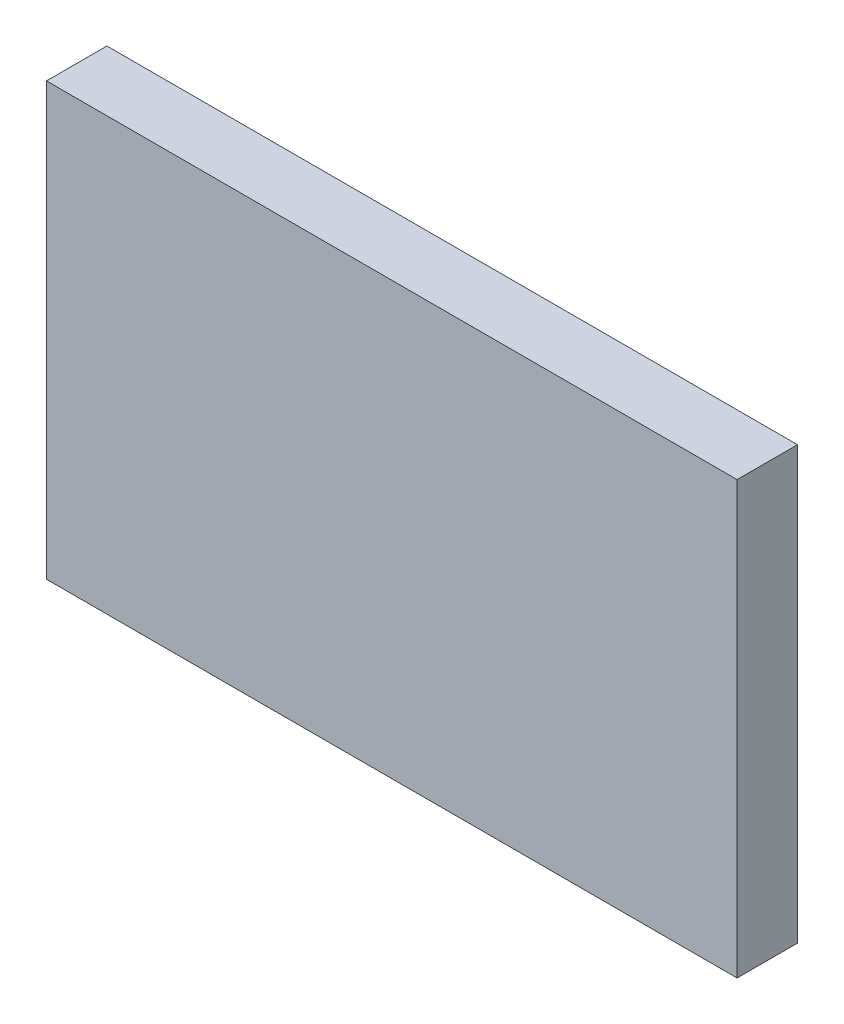
from build123d import *

# Parameters (mm, degrees)
SKETCH4_W           = 80
SKETCH4_H           = 50
BOSS_EXTRUDE2_DEPTH = 7
CUT_EXTRUDE2_DEPTH  = 4


with BuildPart() as part:
    # Sketch4 → Boss-Extrude2 (new body)
    with BuildSketch(Plane.XY):
        Rectangle(SKETCH4_W, SKETCH4_H)
    extrude(amount=-BOSS_EXTRUDE2_DEPTH)

    # Sketch8 → Cut-Extrude2 (cut)
    with BuildSketch(Plane(origin=(0, 0, -7), x_dir=(-1, 0, 0), z_dir=(0, 0, -1))):
        with BuildLine():
            Line((-30, 4), (30, 4))
            ThreePointArc((30, 4), (34, 0), (30, -4))
            Line((30, -4), (-30, -4))
            ThreePointArc((-30, -4), (-34, 0), (-30, 4))
        make_face()
    extrude(amount=-CUT_EXTRUDE2_DEPTH, mode=Mode.SUBTRACT)


solid = part.part
